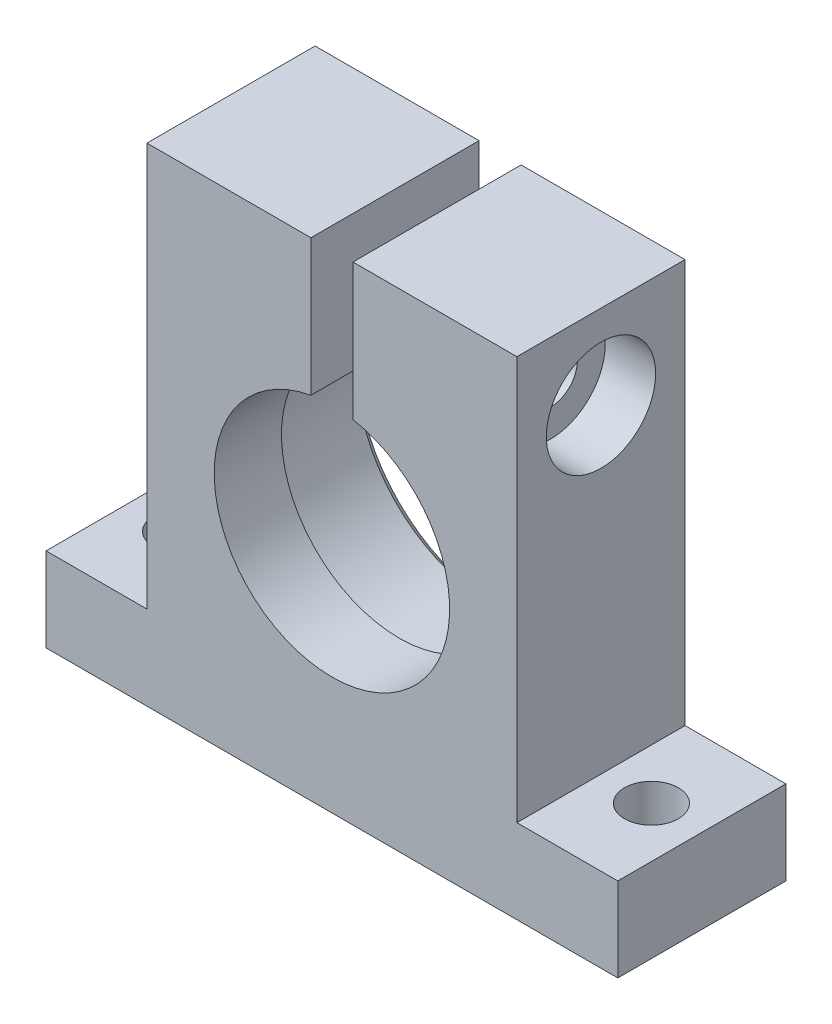
from build123d import *

# Parameters (mm, degrees)
SKETCH1_W                      = 22
SKETCH1_H                      = 29
BOSS_EXTRUDE1_DEPTH            = 5
SKETCH3_W                      = 34
SKETCH3_H                      = 10
BOSS_EXTRUDE2_DEPTH            = 5
F_16_0_16_DIAMETER_HOLE1_D     = 16
F_16_0_16_DIAMETER_HOLE1_DEPTH = 6
F_14_0_14_DIAMETER_HOLE1_D     = 14
M3_CLEARANCE_HOLE1_D           = 3.2
SKETCH12_W                     = 2.5
SKETCH12_H                     = 8.112511343
CUT_EXTRUDE1_DEPTH             = 25.779023387
M3X0_5_TAPPED_HOLE1_D          = 2.5
M3X0_5_TAPPED_HOLE1_DEPTH      = 9.75
CBORE_FOR_M3_SHCS1_D           = 3.2
CBORE_FOR_M3_SHCS1_DEPTH       = 9.75
CBORE_FOR_M3_SHCS1_CBORE_D     = 6.5
CBORE_FOR_M3_SHCS1_CBORE_DEPTH = 3
CHAMFER1_SIZE                  = 0.5


with BuildPart() as part:
    # Sketch1 → Boss-Extrude1 (new, symmetric)
    with BuildSketch(Plane.XY):
        with Locations((0, 0.5)):
            Rectangle(SKETCH1_W, SKETCH1_H)
    extrude(amount=BOSS_EXTRUDE1_DEPTH, both=True)

    # Sketch3 → Boss-Extrude2 (add)
    with BuildSketch(Plane.XZ.offset(14)):
        Rectangle(SKETCH3_W, SKETCH3_H)
    extrude(amount=-BOSS_EXTRUDE2_DEPTH)

    # Ø16.0 (16) Diameter Hole1
    with Locations(Plane(origin=(0, 0, -5), x_dir=(-1, 0, 0), z_dir=(0, 0, -1))):
        with Locations((0, 0)):
            Hole(F_16_0_16_DIAMETER_HOLE1_D / 2, depth=F_16_0_16_DIAMETER_HOLE1_DEPTH)

    # Ø14.0 (14) Diameter Hole1 (through all)
    with Locations(Plane(origin=(0, 0, 1), x_dir=(-1, 0, 0), z_dir=(0, 0, -1))):
        with Locations((0, 0)):
            Hole(F_14_0_14_DIAMETER_HOLE1_D / 2)

    # M3 Clearance Hole1 (through all)
    with Locations(Plane(origin=(0, -9, 0), x_dir=(1, 0, 0), z_dir=(0, 1, 0))):
        with Locations((-14, 0), (14, 0)):
            Hole(M3_CLEARANCE_HOLE1_D / 2)

    # Sketch12 → Cut-Extrude1 (cut, through all)
    with BuildSketch(Plane.XY.offset(5)):
        with Locations((0, 10.943744329)):
            Rectangle(SKETCH12_W, SKETCH12_H)
    extrude(amount=-CUT_EXTRUDE1_DEPTH, mode=Mode.SUBTRACT)

    # M3x0.5 Tapped Hole1
    with Locations(Plane.ZY.offset(11)):
        with Locations((0, 10)):
            Hole(M3X0_5_TAPPED_HOLE1_D / 2, depth=M3X0_5_TAPPED_HOLE1_DEPTH)

    # CBORE for M3 SHCS1
    with Locations(Plane(origin=(11, 0, 0), x_dir=(0, 0, -1), z_dir=(1, 0, 0))):
        with Locations((0, 10)):
            CounterBoreHole(CBORE_FOR_M3_SHCS1_D / 2, CBORE_FOR_M3_SHCS1_CBORE_D / 2, CBORE_FOR_M3_SHCS1_CBORE_DEPTH, depth=CBORE_FOR_M3_SHCS1_DEPTH)

    # Chamfer1
    chamfer1_edges = [part.edges().sort_by_distance(p)[0] for p in [
        (0, -8, -5),
    ]]
    chamfer(chamfer1_edges, length=CHAMFER1_SIZE)


solid = part.part
